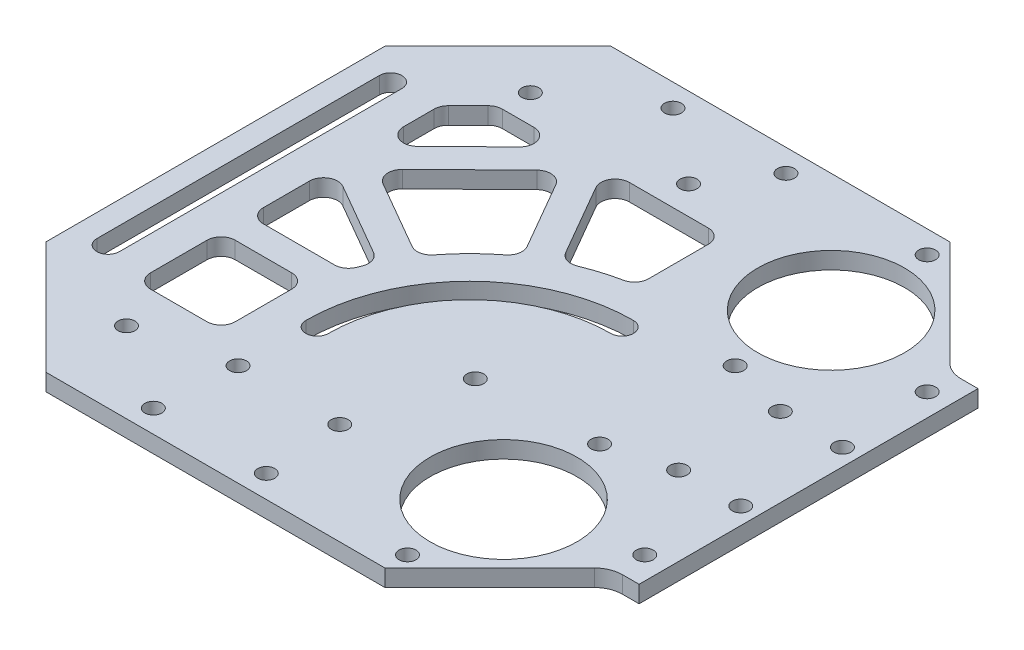
from build123d import *

# Parameters (mm, degrees)
SKETCH_1_R      = 1.5
SKETCH_1_R_2    = 13
SKETCH_1_W      = 15
SKETCH_1_H      = 15
EXTRUDE_1_DEPTH = 3
FILLET_1_R      = 2.5
FILLET_2_R      = 5


with BuildPart() as part:
    # 草图1 → 凸台-拉伸1 (new body)
    with BuildSketch(Plane(origin=(0, 0, 0), x_dir=(1, 0, 0), z_dir=(0, 1, 0))):
        Polygon((-60, 50), (0, 50), (20, 30), (25, 30), (25, -30), (20, -30), (0, -50), (-60, -50), (-80, -30), (-80, 30), align=None)
        with Locations(Location((-45, 46, 0), (0, 0, 270))):
            Circle(SKETCH_1_R, mode=Mode.SUBTRACT)
        with Locations(Location((0, 29, 0), (0, 0, 90))):
            Circle(SKETCH_1_R_2, mode=Mode.SUBTRACT)
        with Locations(Location((-25, 46, 0), (0, 0, 270))):
            Circle(SKETCH_1_R, mode=Mode.SUBTRACT)
        with Locations(Location((-45, -46, 0), (0, 0, 90))):
            Circle(SKETCH_1_R, mode=Mode.SUBTRACT)
        with Locations(Location((-25, -46, 0), (0, 0, 90))):
            Circle(SKETCH_1_R, mode=Mode.SUBTRACT)
        with Locations(Location((-60, 35.75, 0), (0, 0, 270))):
            Circle(SKETCH_1_R, mode=Mode.SUBTRACT)
        with Locations(Location((-32, 35.75, 0), (0, 0, 270))):
            Circle(SKETCH_1_R, mode=Mode.SUBTRACT)
        with Locations(Location((-60, -35.75, 0), (0, 0, 270))):
            Circle(SKETCH_1_R, mode=Mode.SUBTRACT)
        with Locations(Location((-26, -32, 0), (0, 0, 270))):
            Circle(SKETCH_1_R, mode=Mode.SUBTRACT)
        with Locations(Location((-44, -32, 0), (0, 0, 270))):
            Circle(SKETCH_1_R, mode=Mode.SUBTRACT)
        with Locations(Location((11, -9, 0), (0, 0, 270))):
            Circle(SKETCH_1_R, mode=Mode.SUBTRACT)
        with Locations(Location((11, 9, 0), (0, 0, 270))):
            Circle(SKETCH_1_R, mode=Mode.SUBTRACT)
        with Locations(Location((-21, -13, 0), (0, 0, 270))):
            Circle(SKETCH_1_R, mode=Mode.SUBTRACT)
        with Locations(Location((0, -46, 0), (0, 0, 270))):
            Circle(SKETCH_1_R, mode=Mode.SUBTRACT)
        with Locations(Location((0, 46, 0), (0, 0, 270))):
            Circle(SKETCH_1_R, mode=Mode.SUBTRACT)
        with Locations(Location((0, -29, 0), (0, 0, 270))):
            Circle(SKETCH_1_R_2, mode=Mode.SUBTRACT)
        with Locations(Location((22, 9, 0), (0, 0, 270))):
            Circle(SKETCH_1_R, mode=Mode.SUBTRACT)
        with Locations(Location((22, -9, 0), (0, 0, 270))):
            Circle(SKETCH_1_R, mode=Mode.SUBTRACT)
        with Locations(Location((21, 25, 0), (0, 0, 270))):
            Circle(SKETCH_1_R, mode=Mode.SUBTRACT)
        with Locations(Location((21, -25, 0), (0, 0, 270))):
            Circle(SKETCH_1_R, mode=Mode.SUBTRACT)
        with Locations(Location((0, -12, 0), (0, 0, 270))):
            Circle(SKETCH_1_R, mode=Mode.SUBTRACT)
        with Locations(Location((0, 12, 0), (0, 0, 90))):
            Circle(SKETCH_1_R, mode=Mode.SUBTRACT)
        with BuildLine():
            Line((-76, -25), (-76, 25))
            ThreePointArc((-76, 25), (-74, 27), (-72, 25))
            Line((-72, 25), (-72, -25))
            ThreePointArc((-72, -25), (-74, -27), (-76, -25))
        make_face(mode=Mode.SUBTRACT)
        with BuildLine():
            Line((-66, -8), (-49.165832492, -8))
            ThreePointArc((-49.165832492, -8), (-48.371424783, -5.849344075), (-47.437917706, -3.755312305))
            Line((-47.437917706, -3.755312305), (-66, 6.961510904))
            Line((-66, 6.961510904), (-66, -8))
        make_face(mode=Mode.SUBTRACT)
        Polygon((-61, 30.75), (-48.272965565, 30.75), (-66, 13.351215514), (-66, 25.75), align=None, mode=Mode.SUBTRACT)
        with BuildLine():
            Line((-21, 30.75), (-21, 15.588862316))
            ThreePointArc((-21, 15.588862316), (-26.243676334, 14.407879152), (-31.244687695, 12.437917706))
            Line((-31.244687695, 12.437917706), (-41.817173337, 30.75))
            Line((-41.817173337, 30.75), (-21, 30.75))
        make_face(mode=Mode.SUBTRACT)
        with BuildLine():
            Line((-61.900970054, 10.368437553), (-44.937917706, 0.574814714))
            ThreePointArc((-44.937917706, 0.574814714), (-40.703188492, 5.703188492), (-35.574814714, 9.937917706))
            Line((-35.574814714, 9.937917706), (-45.25562103, 26.705566103))
            Line((-45.25562103, 26.705566103), (-61.900970054, 10.368437553))
        make_face(mode=Mode.SUBTRACT)
        with Locations((-58.5, -20.5)):
            Rectangle(SKETCH_1_W, SKETCH_1_H, mode=Mode.SUBTRACT)
        with BuildLine():
            ThreePointArc((-15.95445115, 9.95445115), (-36.460547805, 1.460547805), (-44.95445115, -19.04554885))
            ThreePointArc((-44.95445115, -19.04554885), (-42.95445115, -21.04554885), (-40.95445115, -19.04554885))
            ThreePointArc((-40.95445115, -19.04554885), (-33.63212068, -1.36787932), (-15.95445115, 5.95445115))
            ThreePointArc((-15.95445115, 5.95445115), (-13.95445115, 7.95445115), (-15.95445115, 9.95445115))
        make_face(mode=Mode.SUBTRACT)
    extrude(amount=EXTRUDE_1_DEPTH)

    # 圆角1
    fillet_1_edges = [part.edges().sort_by_distance(p)[0] for p in [
        (-66, 1.5, -6.961510904),
        (-66, 1.5, 8),
        (-49.165832492, 1.5, 8),
        (-47.437917706, 1.5, 3.755312305),
        (-61, 1.5, -30.75),
        (-66, 1.5, -25.75),
        (-66, 1.5, -13.351215514),
        (-48.272965565, 1.5, -30.75),
        (-45.25562103, 1.5, -26.705566103),
        (-61.900970054, 1.5, -10.368437553),
        (-44.937917706, 1.5, -0.574814714),
        (-35.574814714, 1.5, -9.937917706),
        (-66, 1.5, 13),
        (-66, 1.5, 28),
        (-51, 1.5, 28),
        (-51, 1.5, 13),
        (-31.244687695, 1.5, -12.437917706),
        (-21, 1.5, -15.588862316),
        (-21, 1.5, -30.75),
        (-41.817173337, 1.5, -30.75),
    ]]
    fillet(fillet_1_edges, radius=FILLET_1_R)

    # 圆角2
    fillet_2_edges = [part.edges().sort_by_distance(p)[0] for p in [
        (20, 1.5, -30),
        (20, 1.5, 30),
    ]]
    fillet(fillet_2_edges, radius=FILLET_2_R)


solid = part.part
